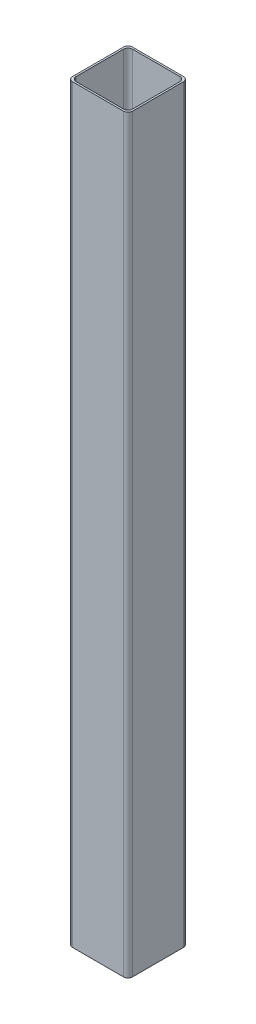
from build123d import *

# Parameters (mm, degrees)
ESBO_O1_W                = 40
ESBO_O1_H                = 40
ESBO_O1_W_2              = 37.6
ESBO_O1_H_2              = 37.6
RESSALTO_EXTRUS_O1_DEPTH = 250
FILETE1_R                = 3


with BuildPart() as part:
    # Esboço1 → Ressalto-extrusão1 (new, symmetric)
    with BuildSketch(Plane(origin=(0, 0, 0), x_dir=(1, 0, 0), z_dir=(0, 1, 0))):
        Rectangle(ESBO_O1_W, ESBO_O1_H)
        Rectangle(ESBO_O1_W_2, ESBO_O1_H_2, mode=Mode.SUBTRACT)
    extrude(amount=RESSALTO_EXTRUS_O1_DEPTH, both=True)

    # Filete1
    filete1_edges = [part.edges().sort_by_distance(p)[0] for p in [
        (-18.8, 0, 18.8),
        (18.8, 0, 18.8),
        (18.8, 0, -18.8),
        (-18.8, 0, -18.8),
        (-20, 0, -20),
        (20, 0, -20),
        (20, 0, 20),
        (-20, 0, 20),
    ]]
    fillet(filete1_edges, radius=FILETE1_R)


solid = part.part
